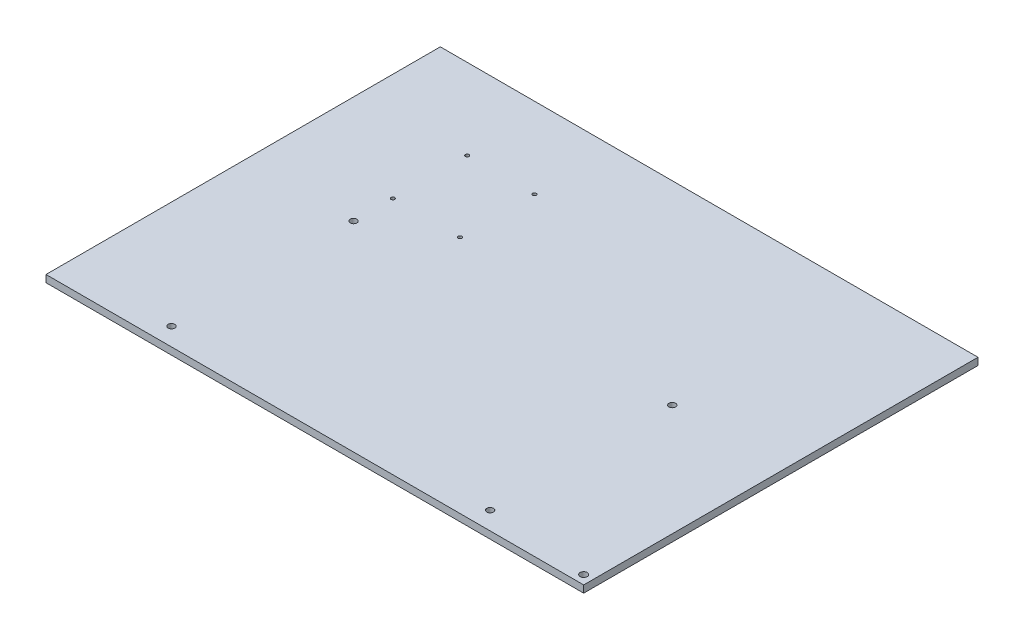
from build123d import *

# Parameters (mm, degrees)
SKETCH1_W               = 300
SKETCH1_H               = 220
BOSS_EXTRUDE1_DEPTH     = 4
CUT_EXTRUDE1_DEPTH      = 187.053755673
CUT_EXTRUDE1_DEPTH_BACK = 187.053755673
SKETCH2_R               = 1.85
CUT_EXTRUDE2_DEPTH      = 187.053755673
CUT_EXTRUDE2_DEPTH_BACK = 187.053755673
SKETCH3_R               = 1
SKETCH4_R               = 2
CUT_EXTRUDE3_DEPTH      = 187.053755673


with BuildPart() as part:
    # Sketch1 → Boss-Extrude1 (new body)
    with BuildSketch(Plane(origin=(0, 0, 0), x_dir=(1, 0, 0), z_dir=(0, 1, 0))):
        Rectangle(SKETCH1_W, SKETCH1_H)
    extrude(amount=BOSS_EXTRUDE1_DEPTH)

    # Sketch2 → Cut-Extrude1 (cut, two sides: drawn at the far end of the back side and taken through both)
    with BuildSketch(Plane(origin=(0, 0, 0), x_dir=(1, 0, 0), z_dir=(0, 1, 0)).offset(-CUT_EXTRUDE1_DEPTH_BACK)):
        with Locations(Location((-90, -100, 0), (0, 0, 270))):
            Circle(SKETCH2_R)
        with Locations(Location((87.8, -100, 0), (0, 0, 270))):
            Circle(SKETCH2_R)
        with Locations(Location((87.8, 1.6, 0), (0, 0, 270))):
            Circle(SKETCH2_R)
        with Locations(Location((-90, 1.6, 0), (0, 0, 270))):
            Circle(SKETCH2_R)
    extrude(amount=CUT_EXTRUDE1_DEPTH + CUT_EXTRUDE1_DEPTH_BACK, mode=Mode.SUBTRACT)

    # Sketch3 → Cut-Extrude2 (cut, two sides: drawn at the far end of the back side and taken through both)
    with BuildSketch(Plane(origin=(0, 4, 0), x_dir=(1, 0, 0), z_dir=(0, 1, 0)).offset(-CUT_EXTRUDE2_DEPTH_BACK)):
        with Locations(Location((-90, 65, 0), (0, 0, 270))):
            Circle(SKETCH3_R)
        with Locations(Location((-52.5, 65, 0), (0, 0, 270))):
            Circle(SKETCH3_R)
        with Locations(Location((-52.5, 23.5, 0), (0, 0, 270))):
            Circle(SKETCH3_R)
        with Locations(Location((-90, 23.5, 0), (0, 0, 270))):
            Circle(SKETCH3_R)
    extrude(amount=CUT_EXTRUDE2_DEPTH + CUT_EXTRUDE2_DEPTH_BACK, mode=Mode.SUBTRACT)

    # Sketch4 → Cut-Extrude3 (cut, through all)
    with BuildSketch(Plane(origin=(0, 4, 0), x_dir=(1, 0, 0), z_dir=(0, 1, 0))):
        with Locations(Location((145, -105, 0), (0, 0, 270))):
            Circle(SKETCH4_R)
    extrude(amount=-CUT_EXTRUDE3_DEPTH, mode=Mode.SUBTRACT)


solid = part.part
